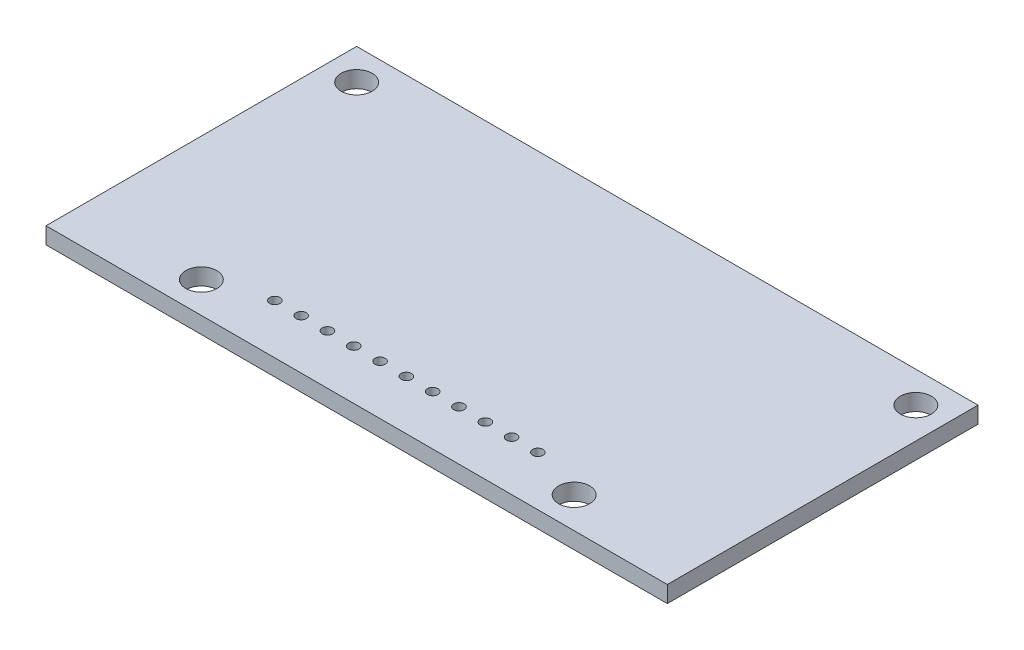
from build123d import *

# Parameters (mm, degrees)
SKETCH1_W           = 60
SKETCH1_H           = 30
SKETCH1_R           = 1.5
SKETCH1_R_2         = 0.5
BOSS_EXTRUDE1_DEPTH = 1.6


with BuildPart() as part:
    # Sketch1 → Boss-Extrude1 (new body)
    with BuildSketch(Plane(origin=(0, 0, 0), x_dir=(1, 0, 0), z_dir=(0, 1, 0))):
        Rectangle(SKETCH1_W, SKETCH1_H)
        with Locations(Location((-27, 12, 0), (0, 0, 270))):
            Circle(SKETCH1_R, mode=Mode.SUBTRACT)
        with Locations(Location((-18, -12, 0), (0, 0, 270))):
            Circle(SKETCH1_R, mode=Mode.SUBTRACT)
        with Locations(Location((18, -12, 0), (0, 0, 270))):
            Circle(SKETCH1_R, mode=Mode.SUBTRACT)
        with Locations(Location((27, 12, 0), (0, 0, 270))):
            Circle(SKETCH1_R, mode=Mode.SUBTRACT)
        with Locations(Location((-12.7, -10.2, 0), (0, 0, 270))):
            Circle(SKETCH1_R_2, mode=Mode.SUBTRACT)
        with Locations(Location((-10.16, -10.2, 0), (0, 0, 270))):
            Circle(SKETCH1_R_2, mode=Mode.SUBTRACT)
        with Locations(Location((-7.62, -10.2, 0), (0, 0, 270))):
            Circle(SKETCH1_R_2, mode=Mode.SUBTRACT)
        with Locations(Location((-5.08, -10.2, 0), (0, 0, 270))):
            Circle(SKETCH1_R_2, mode=Mode.SUBTRACT)
        with Locations(Location((-2.54, -10.2, 0), (0, 0, 270))):
            Circle(SKETCH1_R_2, mode=Mode.SUBTRACT)
        with Locations(Location((0, -10.2, 0), (0, 0, 270))):
            Circle(SKETCH1_R_2, mode=Mode.SUBTRACT)
        with Locations(Location((2.54, -10.2, 0), (0, 0, 270))):
            Circle(SKETCH1_R_2, mode=Mode.SUBTRACT)
        with Locations(Location((5.08, -10.2, 0), (0, 0, 270))):
            Circle(SKETCH1_R_2, mode=Mode.SUBTRACT)
        with Locations(Location((7.62, -10.2, 0), (0, 0, 270))):
            Circle(SKETCH1_R_2, mode=Mode.SUBTRACT)
        with Locations(Location((10.16, -10.2, 0), (0, 0, 270))):
            Circle(SKETCH1_R_2, mode=Mode.SUBTRACT)
        with Locations(Location((12.7, -10.2, 0), (0, 0, 270))):
            Circle(SKETCH1_R_2, mode=Mode.SUBTRACT)
    extrude(amount=BOSS_EXTRUDE1_DEPTH)


solid = part.part
